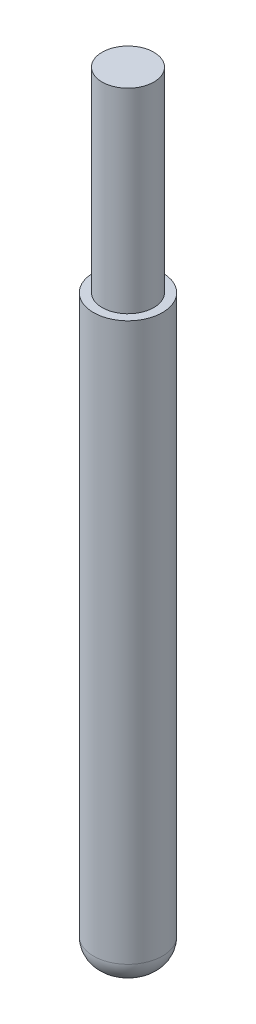
from build123d import *

# Parameters (mm, degrees)
SKETCH1_R           = 3
BOSS_EXTRUDE1_DEPTH = 50.5
FILLET1_R           = 2
SKETCH2_R           = 2.25
BOSS_EXTRUDE2_DEPTH = 17


with BuildPart() as part:
    # Sketch1 → Boss-Extrude1 (new body)
    with BuildSketch(Plane(origin=(0, 0, 0), x_dir=(1, 0, 0), z_dir=(0, 1, 0))):
        with Locations(Location((0, 0, 0), (0, 0, 270))):
            Circle(SKETCH1_R)
    extrude(amount=BOSS_EXTRUDE1_DEPTH)

    # Fillet1
    fillet1_edges = [part.edges().sort_by_distance(p)[0] for p in [
        (0, 0, -3),
    ]]
    fillet(fillet1_edges, radius=FILLET1_R)

    # Sketch2 → Boss-Extrude2 (add)
    with BuildSketch(Plane(origin=(0, 50.5, 0), x_dir=(1, 0, 0), z_dir=(0, 1, 0))):
        with Locations(Location((0, 0, 0), (0, 0, 270))):
            Circle(SKETCH2_R)
    extrude(amount=BOSS_EXTRUDE2_DEPTH)


solid = part.part
